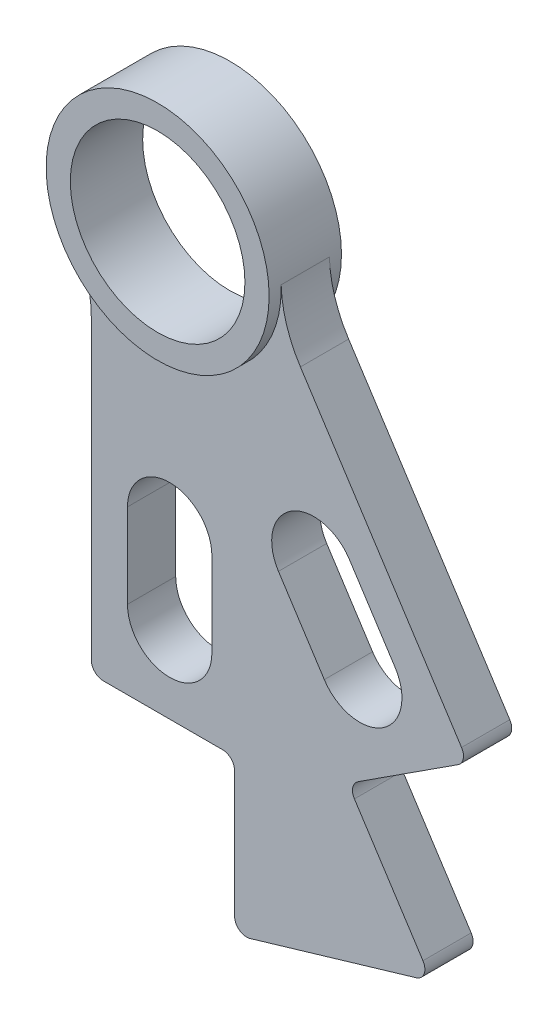
from build123d import *

# Parameters (mm, degrees)
SKETCH1_R           = 11.495405
BOSS_EXTRUDE2_DEPTH = 4.7625
BOSS_EXTRUDE3_DEPTH = 3.175
FILLET1_R           = 1.5875


with BuildPart() as part:
    # Sketch1 → Boss-Extrude2 (new, symmetric)
    with BuildSketch(Plane.XY):
        with BuildLine():
            ThreePointArc((14.672983865, 0.491098707), (-4.158599684, 14.079903484), (-12.585193267, -7.559797873))
            ThreePointArc((-12.585193267, -7.559797873), (4.158599684, -14.079903484), (14.672983865, 0.491098707))
        make_face()
        with Locations(Location((0, 0, 0), (0, 0, 180))):
            Circle(SKETCH1_R, mode=Mode.SUBTRACT)
    extrude(amount=BOSS_EXTRUDE2_DEPTH, both=True)

    # Sketch1<4> → Boss-Extrude3 (add, symmetric)
    with BuildSketch(Plane.XY):
        with BuildLine():
            ThreePointArc((-12.585193267, -7.559797873), (-10.89585042, -11.492870345), (-10.31875, -15.734319794))
            Line((-10.31875, -15.734319794), (-10.31875, -56.374319794))
            Line((-10.31875, -56.374319794), (8.54075, -56.374319794))
            Line((8.54075, -56.374319794), (8.54075, -76.694319794))
            Line((8.54075, -76.694319794), (34.499171822, -69.027315193))
            Line((34.499171822, -69.027315193), (23.458960581, -51.968120144))
            Line((23.458960581, -51.968120144), (39.292025986, -41.721424085))
            Line((39.292025986, -41.721424085), (17.211603503, -7.603033986))
            ThreePointArc((17.211603503, -7.603033986), (15.391641433, -3.728672569), (14.672983865, 0.491098707))
            ThreePointArc((14.672983865, 0.491098707), (4.158599684, -14.079903484), (-12.585193267, -7.559797873))
        make_face()
        with BuildLine():
            ThreePointArc((5.55625, -46.055569794), (0, -51.611819794), (-5.55625, -46.055569794))
            Line((-5.55625, -46.055569794), (-5.55625, -34.943069794))
            ThreePointArc((-5.55625, -34.943069794), (0, -29.386819794), (5.55625, -34.943069794))
            Line((5.55625, -34.943069794), (5.55625, -46.055569794))
        make_face(mode=Mode.SUBTRACT)
        with BuildLine():
            ThreePointArc((29.687419875, -35.646101109), (28.04160399, -43.329532516), (20.358172583, -41.683716631))
            Line((20.358172583, -41.683716631), (14.32055706, -32.354469339))
            ThreePointArc((14.32055706, -32.354469339), (15.966372945, -24.671037931), (23.649804353, -26.316853816))
            Line((23.649804353, -26.316853816), (29.687419875, -35.646101109))
        make_face(mode=Mode.SUBTRACT)
    extrude(amount=BOSS_EXTRUDE3_DEPTH, both=True)

    # Fillet1
    fillet1_edges = [part.edges().sort_by_distance(p)[0] for p in [
        (34.499171822, -69.027315193, 0),
        (23.458960581, -51.968120144, 0),
        (39.292025986, -41.721424085, 0),
        (-10.31875, -56.374319794, 0),
        (8.54075, -56.374319794, 0),
        (8.54075, -76.694319794, 0),
    ]]
    fillet(fillet1_edges, radius=FILLET1_R)


solid = part.part
